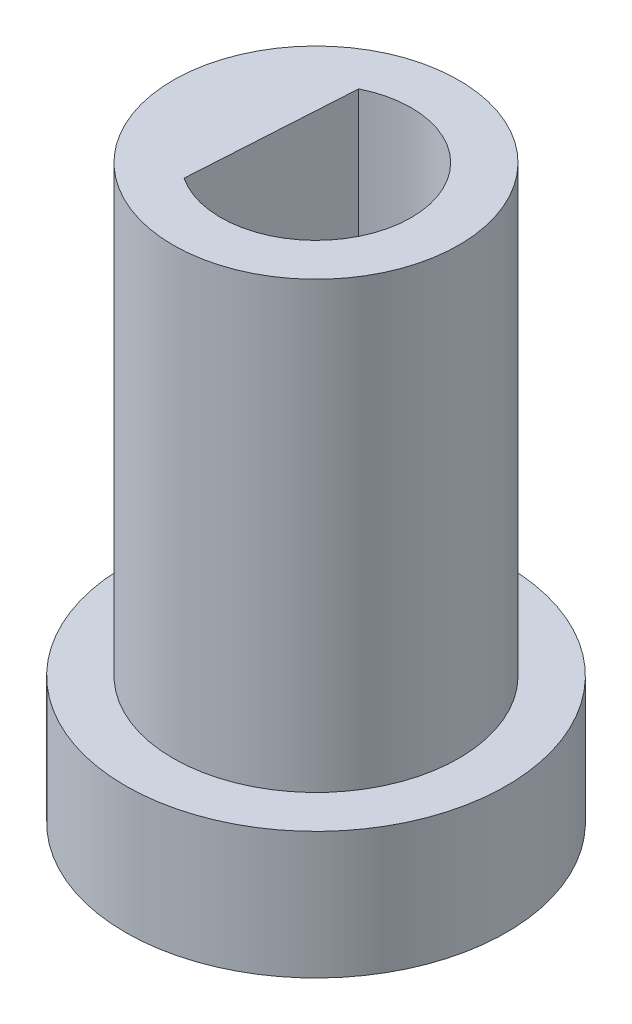
from build123d import *

# Parameters (mm, degrees)
SKETCH1_R           = 6
BOSS_EXTRUDE1_DEPTH = 4
SKETCH2_R           = 4.5
BOSS_EXTRUDE2_DEPTH = 14
SKETCH3_W           = 5
SKETCH3_H           = 5
CUT_EXTRUDE1_DEPTH  = 4
SKETCH4_R           = 3
CUT_EXTRUDE2_DEPTH  = 10
BOSS_EXTRUDE3_START = 10
BOSS_EXTRUDE3_DEPTH = 10


with BuildPart() as part:
    # Sketch1 → Boss-Extrude1 (new body)
    with BuildSketch(Plane(origin=(0, 0, 0), x_dir=(1, 0, 0), z_dir=(0, 1, 0))):
        with Locations(Location((0, 0, 0), (0, 0, 270))):
            Circle(SKETCH1_R)
    extrude(amount=BOSS_EXTRUDE1_DEPTH)

    # Sketch2 → Boss-Extrude2 (add)
    with BuildSketch(Plane(origin=(0, 4, 0), x_dir=(1, 0, 0), z_dir=(0, 1, 0))):
        with Locations(Location((0, 0, 0), (0, 0, 270))):
            Circle(SKETCH2_R)
    extrude(amount=BOSS_EXTRUDE2_DEPTH)

    # Sketch3 → Cut-Extrude1 (cut)
    with BuildSketch(Plane(origin=(0, 0, 0), x_dir=(-1, 0, 0), z_dir=(0, -1, 0))):
        Rectangle(SKETCH3_W, SKETCH3_H)
    extrude(amount=-CUT_EXTRUDE1_DEPTH, mode=Mode.SUBTRACT)

    # Sketch4 → Cut-Extrude2 (cut)
    with BuildSketch(Plane(origin=(0, 18, 0), x_dir=(1, 0, 0), z_dir=(0, 1, 0))):
        with Locations(Location((0, 0, 0), (0, 0, 270))):
            Circle(SKETCH4_R)
    extrude(amount=-CUT_EXTRUDE2_DEPTH, mode=Mode.SUBTRACT)

    # Sketch5 → Boss-Extrude3 (add)
    with BuildSketch(Plane(origin=(0, 8, 0), x_dir=(1, 0, 0), z_dir=(0, 1, 0)).offset(BOSS_EXTRUDE3_START)):
        with BuildLine():
            Line((-1.65486069, -2.502286174), (-1.33961305, 2.684294484))
            ThreePointArc((-1.33961305, 2.684294484), (-2.994473739, 0.18200831), (-1.65486069, -2.502286174))
        make_face()
    extrude(amount=-BOSS_EXTRUDE3_DEPTH)


solid = part.part
